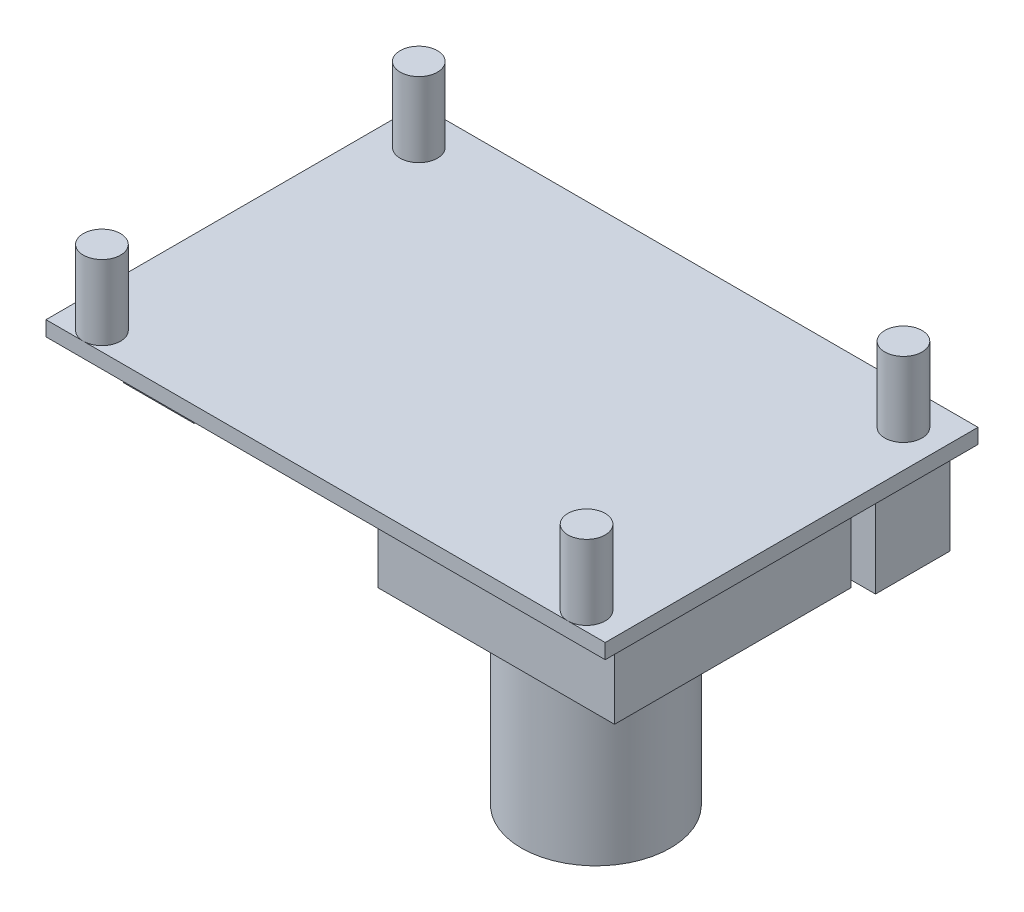
from build123d import *

# Parameters (mm, degrees)
P01_STANDOFF_START             = 28.6
SK_P01_STANDOFF_R              = 2
P01_STANDOFF_DEPTH             = 8
P02_STANDOFF_START             = 28.6
SK_P02_STANDOFF_R              = 2
P02_STANDOFF_DEPTH             = 8
P03_STANDOFF_START             = 28.6
SK_P03_STANDOFF_R              = 2
P03_STANDOFF_DEPTH             = 8
P04_STANDOFF_START             = 28.6
SK_P04_STANDOFF_R              = 2
P04_STANDOFF_DEPTH             = 8
P05_CARRIERBOARD_START         = 27
SK_P05_CARRIERBOARD_W          = 60
SK_P05_CARRIERBOARD_H          = 40
P05_CARRIERBOARD_DEPTH         = 1.6
P06_INA2602COMPUTE_START       = 24.3
SK_P06_INA2602COMPUTE_W        = 22.9
SK_P06_INA2602COMPUTE_H        = 23
P06_INA2602COMPUTE_DEPTH       = 2.7
P07_INA260TERMINALBLOCK_START  = 14.3
SK_P07_INA260TERMINALBLOCK_W   = 10
SK_P07_INA260TERMINALBLOCK_H   = 8
P07_INA260TERMINALBLOCK_DEPTH  = 10
P08_BUCKAD36V50F551V_START     = 17.5
SK_P08_BUCKAD36V50F551V_W      = 25.4
SK_P08_BUCKAD36V50F551V_H      = 25.4
P08_BUCKAD36V50F551V_DEPTH     = 9.5
P09_JSTXHHEADERSFACEDOWN_START = 16.6
SK_P09_JSTXHHEADERSFACEDOWN_W  = 56
SK_P09_JSTXHHEADERSFACEDOWN_H  = 8
P09_JSTXHHEADERSFACEDOWN_DEPTH = 10.4
P10_D2IDEALDIODE_START         = 24.6
SK_P10_D2IDEALDIODE_W          = 7.6
SK_P10_D2IDEALDIODE_H          = 12.7
P10_D2IDEALDIODE_DEPTH         = 2.4
SK_P11_C14700UF25V_R           = 8
P11_C14700UF25V_DEPTH          = 27


with BuildPart() as part:
    # SK_P01_Standoff → P01_Standoff (new body)
    with BuildSketch(Plane(origin=(0, 0, 0), x_dir=(1, 0, 0), z_dir=(0, 1, 0)).offset(P01_STANDOFF_START)):
        with Locations(Location((-26, -18, 0), (0, 0, 270))):
            Circle(SK_P01_STANDOFF_R)
    extrude(amount=P01_STANDOFF_DEPTH)



with BuildPart() as body_2:
    # SK_P02_Standoff → P02_Standoff (new body)
    with BuildSketch(Plane(origin=(0, 0, 0), x_dir=(1, 0, 0), z_dir=(0, 1, 0)).offset(P02_STANDOFF_START)):
        with Locations(Location((-26, 16, 0), (0, 0, 270))):
            Circle(SK_P02_STANDOFF_R)
    extrude(amount=P02_STANDOFF_DEPTH)


with BuildPart() as body_3:
    # SK_P03_Standoff → P03_Standoff (new body)
    with BuildSketch(Plane(origin=(0, 0, 0), x_dir=(1, 0, 0), z_dir=(0, 1, 0)).offset(P03_STANDOFF_START)):
        with Locations(Location((26, -18, 0), (0, 0, 270))):
            Circle(SK_P03_STANDOFF_R)
    extrude(amount=P03_STANDOFF_DEPTH)


with BuildPart() as body_4:
    # SK_P04_Standoff → P04_Standoff (new body)
    with BuildSketch(Plane(origin=(0, 0, 0), x_dir=(1, 0, 0), z_dir=(0, 1, 0)).offset(P04_STANDOFF_START)):
        with Locations(Location((26, 16, 0), (0, 0, 270))):
            Circle(SK_P04_STANDOFF_R)
    extrude(amount=P04_STANDOFF_DEPTH)


with BuildPart() as part_1:
    add(part.part)

    add(body_2.part)  # P05_Carrierboard merges body 2

    add(body_3.part)  # P05_Carrierboard merges body 3

    add(body_4.part)  # P05_Carrierboard merges body 4
    # SK_P05_Carrierboard → P05_Carrierboard (add)
    with BuildSketch(Plane(origin=(0, 0, 0), x_dir=(1, 0, 0), z_dir=(0, 1, 0)).offset(P05_CARRIERBOARD_START)):
        Rectangle(SK_P05_CARRIERBOARD_W, SK_P05_CARRIERBOARD_H)
    extrude(amount=P05_CARRIERBOARD_DEPTH)

    # SK_P06_INA2602compute → P06_INA2602compute (add)
    with BuildSketch(Plane(origin=(0, 0, 0), x_dir=(1, 0, 0), z_dir=(0, 1, 0)).offset(P06_INA2602COMPUTE_START)):
        with Locations((-16.55, -4.5)):
            Rectangle(SK_P06_INA2602COMPUTE_W, SK_P06_INA2602COMPUTE_H)
    extrude(amount=P06_INA2602COMPUTE_DEPTH)

    # SK_P07_INA260terminalblock → P07_INA260terminalblock (add)
    with BuildSketch(Plane(origin=(0, 0, 0), x_dir=(1, 0, 0), z_dir=(0, 1, 0)).offset(P07_INA260TERMINALBLOCK_START)):
        with Locations((-20, 1)):
            Rectangle(SK_P07_INA260TERMINALBLOCK_W, SK_P07_INA260TERMINALBLOCK_H)
    extrude(amount=P07_INA260TERMINALBLOCK_DEPTH)

    # SK_P08_BuckAD36V50F551V → P08_BuckAD36V50F551V (add)
    with BuildSketch(Plane(origin=(0, 0, 0), x_dir=(1, 0, 0), z_dir=(0, 1, 0)).offset(P08_BUCKAD36V50F551V_START)):
        with Locations((14.3, -3.3)):
            Rectangle(SK_P08_BUCKAD36V50F551V_W, SK_P08_BUCKAD36V50F551V_H)
    extrude(amount=P08_BUCKAD36V50F551V_DEPTH)

    # SK_P09_JSTXHheadersfacedown → P09_JSTXHheadersfacedown (add)
    with BuildSketch(Plane(origin=(0, 0, 0), x_dir=(1, 0, 0), z_dir=(0, 1, 0)).offset(P09_JSTXHHEADERSFACEDOWN_START)):
        with Locations((0, 15)):
            Rectangle(SK_P09_JSTXHHEADERSFACEDOWN_W, SK_P09_JSTXHHEADERSFACEDOWN_H)
    extrude(amount=P09_JSTXHHEADERSFACEDOWN_DEPTH)

    # SK_P10_D2idealdiode → P10_D2idealdiode (add)
    with BuildSketch(Plane(origin=(0, 0, 0), x_dir=(1, 0, 0), z_dir=(0, 1, 0)).offset(P10_D2IDEALDIODE_START)):
        with Locations((-20.2, -11.35)):
            Rectangle(SK_P10_D2IDEALDIODE_W, SK_P10_D2IDEALDIODE_H)
    extrude(amount=P10_D2IDEALDIODE_DEPTH)

    # SK_P11_C14700uF25V → P11_C14700uF25V (add)
    with BuildSketch(Plane(origin=(0, 0, 0), x_dir=(1, 0, 0), z_dir=(0, 1, 0))):
        with Locations(Location((16, -7, 0), (0, 0, 270))):
            Circle(SK_P11_C14700UF25V_R)
    extrude(amount=P11_C14700UF25V_DEPTH)


solid = part_1.part
